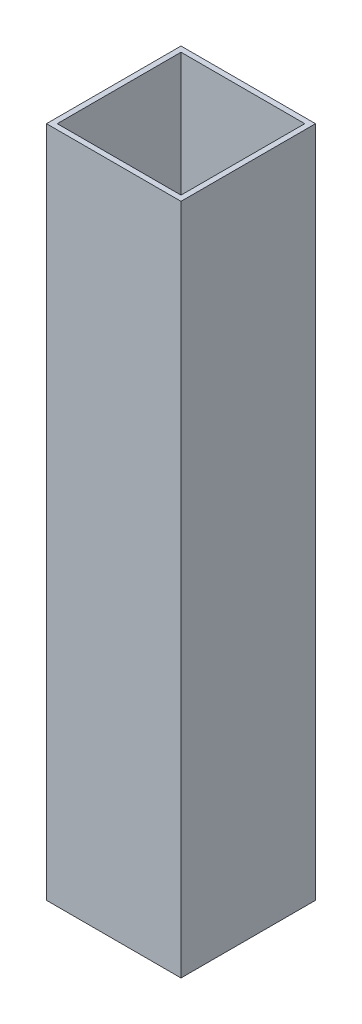
from build123d import *

# Parameters (mm, degrees)
SKETCH21_W                   = 50
SKETCH21_H                   = 50
SKETCH21_W_2                 = 46
SKETCH21_H_2                 = 46
PTR_ASTM_A36_50X50X2_1_DEPTH = 250


with BuildPart() as part:
    # Sketch21 → Ptr ASTM A36 50X50X2(1) (new body)
    with BuildSketch(Plane(origin=(0, 0, 0), x_dir=(-1, 0, 0), z_dir=(0, 1, 0))):
        Rectangle(SKETCH21_W, SKETCH21_H)
        Rectangle(SKETCH21_W_2, SKETCH21_H_2, mode=Mode.SUBTRACT)
    extrude(amount=PTR_ASTM_A36_50X50X2_1_DEPTH)


solid = part.part
